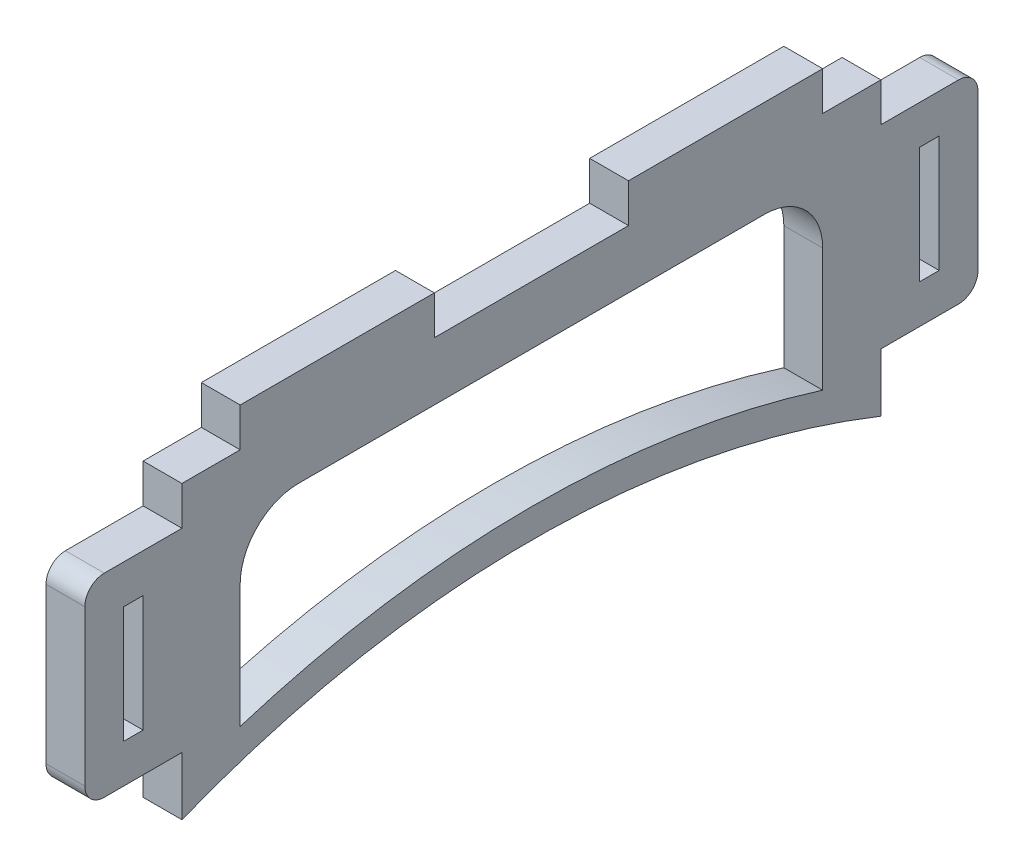
from build123d import *

# Parameters (mm, degrees)
SKETCH1_W           = 1
SKETCH1_H           = 6
BOSS_EXTRUDE1_DEPTH = 2


with BuildPart() as part:
    # Sketch1 → Boss-Extrude1 (new body)
    with BuildSketch(Plane(origin=(0, 0, 0), x_dir=(0, 0, -1), z_dir=(1, 0, 0))):
        with BuildLine():
            Line((-18, 0), (-15, 0))
            Line((-15, 0), (-15, 2))
            Line((-15, 2), (-5, 2))
            Line((-5, 2), (-5, 0))
            Line((-5, 0), (5, 0))
            Line((5, 0), (5, 2))
            Line((5, 2), (15, 2))
            Line((15, 2), (15, 0))
            Line((15, 0), (18, 0))
            Line((18, 0), (18, -2))
            Line((18, -2), (22, -2))
            ThreePointArc((22, -2), (22.707106781, -2.292893219), (23, -3))
            Line((23, -3), (23, -11))
            ThreePointArc((23, -11), (22.707106781, -11.707106781), (22, -12))
            Line((22, -12), (18, -12))
            Line((18, -12), (18, -15))
            ThreePointArc((18, -15), (0, -11.536096634), (-18, -15))
            Line((-18, -15), (-18, -12))
            Line((-18, -12), (-22, -12))
            ThreePointArc((-22, -12), (-22.707106781, -11.707106781), (-23, -11))
            Line((-23, -11), (-23, -3))
            ThreePointArc((-23, -3), (-22.707106781, -2.292893219), (-22, -2))
            Line((-22, -2), (-18, -2))
            Line((-18, -2), (-18, 0))
        make_face()
        with BuildLine():
            Line((-15, -12.339136563), (-15, -6))
            ThreePointArc((-15, -6), (-14.121320344, -3.878679656), (-12, -3))
            Line((-12, -3), (12, -3))
            ThreePointArc((12, -3), (14.121320344, -3.878679656), (15, -6))
            Line((15, -6), (15, -12.339136563))
            ThreePointArc((15, -12.339136563), (0, -10.036096634), (-15, -12.339136563))
        make_face(mode=Mode.SUBTRACT)
        with Locations((-20.5, -7)):
            Rectangle(SKETCH1_W, SKETCH1_H, mode=Mode.SUBTRACT)
        with Locations((20.5, -7)):
            Rectangle(SKETCH1_W, SKETCH1_H, mode=Mode.SUBTRACT)
    extrude(amount=BOSS_EXTRUDE1_DEPTH)


solid = part.part
